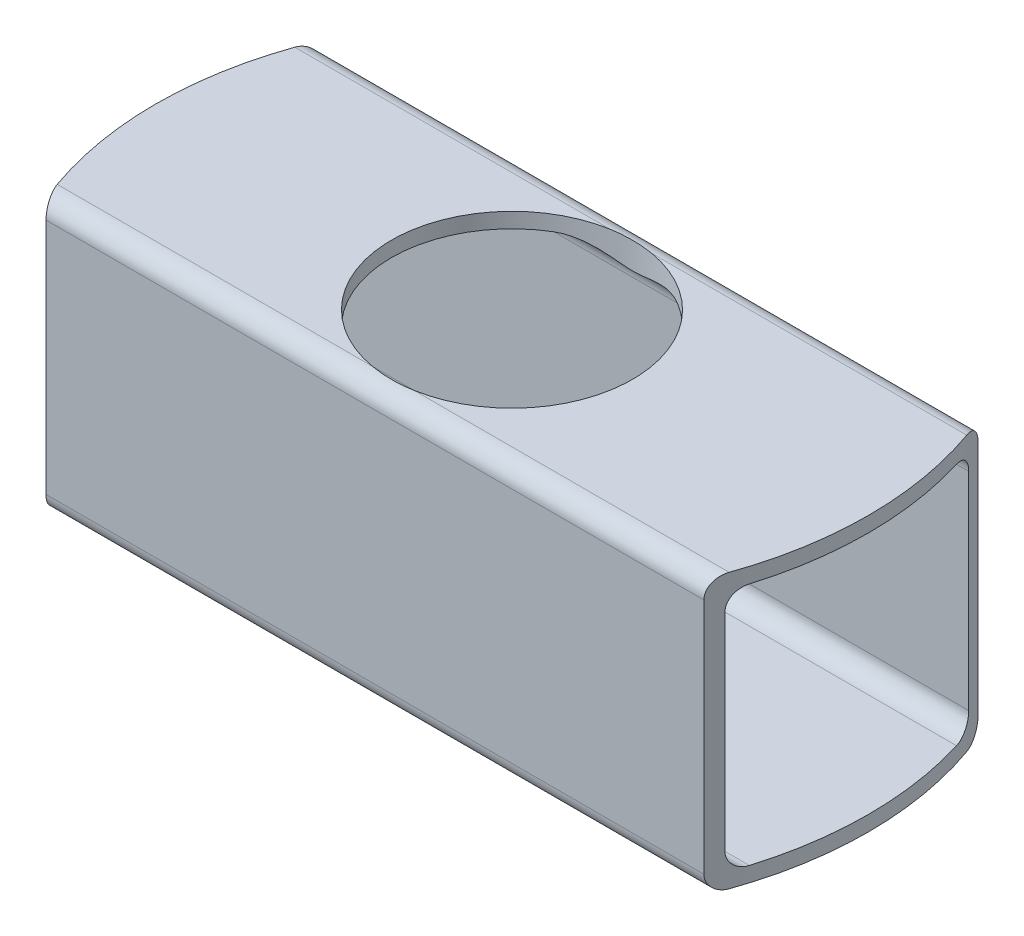
from build123d import *

# Parameters (mm, degrees)
SKETCH1_W           = 38.1
SKETCH1_H           = 38.1
SKETCH1_W_2         = 33.8836
SKETCH1_H_2         = 33.8836
BOSS_EXTRUDE1_DEPTH = 50.8
FILLET1_R           = 2.54
SKETCH3_R           = 16.764
CUT_EXTRUDE2_DEPTH  = 67.295946332
CUT_EXTRUDE3_DEPTH  = 67.295946494


with BuildPart() as part:
    # Sketch1 → Boss-Extrude1 (new, symmetric)
    with BuildSketch(Plane(origin=(0, 0, 0), x_dir=(0, 0, -1), z_dir=(1, 0, 0))):
        Rectangle(SKETCH1_W, SKETCH1_H)
        Rectangle(SKETCH1_W_2, SKETCH1_H_2, mode=Mode.SUBTRACT)
    extrude(amount=BOSS_EXTRUDE1_DEPTH, both=True)

    # Fillet1
    fillet1_edges = [part.edges().sort_by_distance(p)[0] for p in [
        (0, -16.9418, -16.9418),
        (0, 16.9418, -16.9418),
        (0, 16.9418, 16.9418),
        (0, -16.9418, 16.9418),
        (0, 19.05, 19.05),
        (0, 19.05, -19.05),
        (0, -19.05, -19.05),
        (0, -19.05, 19.05),
    ]]
    fillet(fillet1_edges, radius=FILLET1_R)

    # Sketch3 → Cut-Extrude2 (cut, through all)
    with BuildSketch(Plane(origin=(0, 19.05, 0), x_dir=(1, 0, 0), z_dir=(0, 1, 0))):
        with Locations(Location((0, 0, 0), (0, 0, 279.986551447))):
            Circle(SKETCH3_R)
    extrude(amount=-CUT_EXTRUDE2_DEPTH, mode=Mode.SUBTRACT)

    # Sketch4 → Cut-Extrude3 (cut, through all)
    with BuildSketch(Plane(origin=(0, 19.05, 0), x_dir=(1, 0, 0), z_dir=(0, 1, 0))):
        with BuildLine():
            Line((-45.72, 19.05), (-50.8, 19.05))
            Line((-50.8, 19.05), (-50.8, -19.05))
            Line((-50.8, -19.05), (-45.72, -19.05))
            ThreePointArc((-45.72, -19.05), (-49.53, 0), (-45.72, 19.05))
        make_face()
        with BuildLine():
            Line((50.8, 16.51), (46.69733183, 16.51))
            ThreePointArc((46.69733183, 16.51), (48.81669666, 8.375621006), (49.53, 0))
            ThreePointArc((49.53, 0), (48.81669666, -8.375621006), (46.69733183, -16.51))
            Line((46.69733183, -16.51), (50.8, -16.51))
            Line((50.8, -16.51), (50.8, 16.51))
        make_face()
        with BuildLine():
            Line((50.8, 19.05), (45.72, 19.05))
            ThreePointArc((45.72, 19.05), (46.226114974, 17.786713985), (46.69733183, 16.51))
            Line((46.69733183, 16.51), (50.8, 16.51))
            Line((50.8, 16.51), (50.8, 19.05))
        make_face()
        with BuildLine():
            ThreePointArc((46.69733183, -16.51), (46.226114974, -17.786713985), (45.72, -19.05))
            Line((45.72, -19.05), (50.8, -19.05))
            Line((50.8, -19.05), (50.8, -16.51))
            Line((50.8, -16.51), (46.69733183, -16.51))
        make_face()
    extrude(amount=-CUT_EXTRUDE3_DEPTH, mode=Mode.SUBTRACT)


solid = part.part
